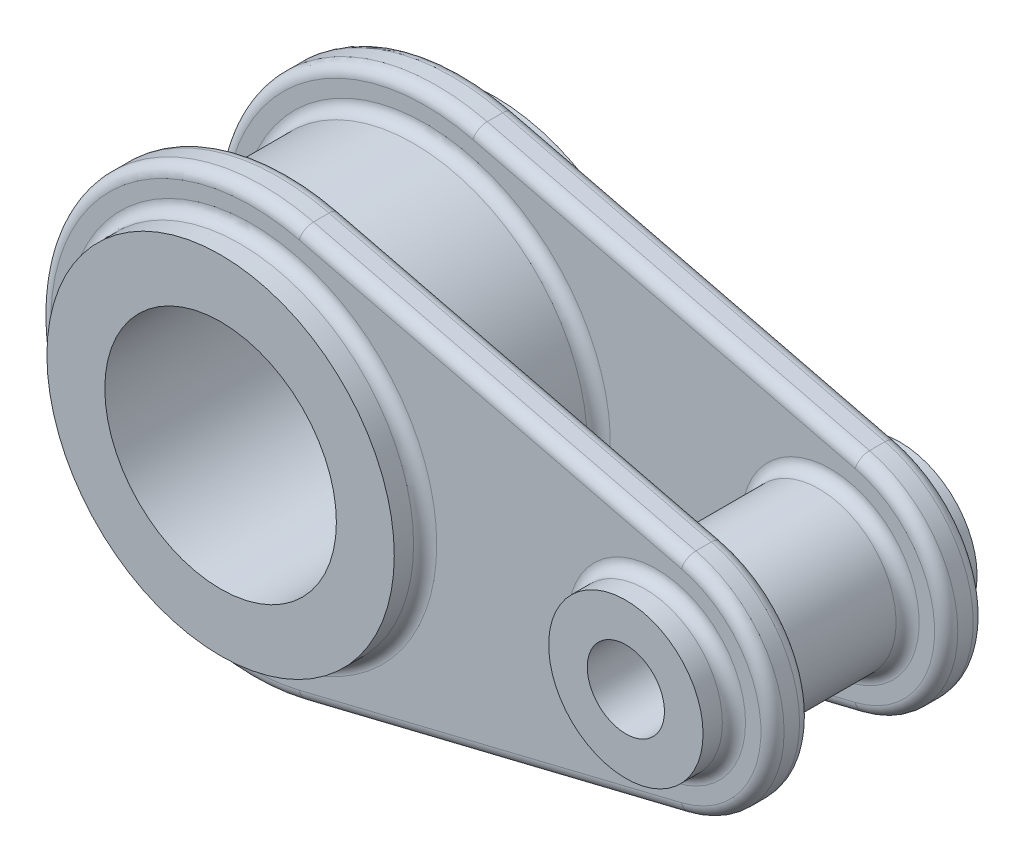
from build123d import *

# Parameters (mm, degrees)
SKETCH_1_R          = 45
EXTRUDE_1_DEPTH     = 35.5
SKETCH_1_R_2        = 20
EXTRUDE_1_2_DEPTH   = 35.5
EXTRUDE_2_DEPTH     = 10
SKETCH_3_R          = 30
SKETCH_3_R_2        = 10
CUT_EXTRUDE_1_DEPTH = 163.144996839
FILLET_1_R          = 3


with BuildPart() as part:
    # 草图1 → 凸台-拉伸1 (new, symmetric)
    with BuildSketch(Plane.XY):
        Circle(SKETCH_1_R)
    extrude(amount=EXTRUDE_1_DEPTH, both=True)



with BuildPart() as body_2:
    # 草图1 → Extrude 1 2 (new, symmetric)
    with BuildSketch(Plane.XY):
        with Locations((105, 0)):
            Circle(SKETCH_1_R_2)
    extrude(amount=EXTRUDE_1_2_DEPTH, both=True)


with BuildPart() as part_1:
    add(part.part)

    add(body_2.part)  # 凸台-拉伸2 merges body 2
    # 草图2 → 凸台-拉伸2 (add)
    with BuildSketch(Plane.XY.offset(17.5)):
        with BuildLine():
            Line((13.095238095, 53.418299666), (112.142857143, 29.137254363))
            ThreePointArc((112.142857143, 29.137254363), (135, 0), (112.142857143, -29.137254363))
            Line((112.142857143, -29.137254363), (13.095238095, -53.418299666))
            ThreePointArc((13.095238095, -53.418299666), (-55, 0), (13.095238095, 53.418299666))
        make_face()
    extrude_2 = extrude(amount=EXTRUDE_2_DEPTH)

    # 镜向1: 凸台-拉伸2 across plane
    add(extrude_2.mirror(Plane.XY))

    # 草图3 → 切除-拉伸1 (cut, through all)
    with BuildSketch(Plane.XY.offset(35.5)):
        Circle(SKETCH_3_R)
        with Locations((105, 0)):
            Circle(SKETCH_3_R_2)
    extrude(amount=-CUT_EXTRUDE_1_DEPTH, mode=Mode.SUBTRACT)

    # 圆角1
    fillet_1_edges = [part_1.edges().sort_by_distance(p)[0] for p in [
        (-45, 0, 27.5),
        (-55, 0, 17.5),
        (62.619047619, -41.277777015, 17.5),
        (135, 0, 17.5),
        (62.619047619, 41.277777015, 17.5),
        (-55, 0, 27.5),
        (62.619047619, -41.277777015, 27.5),
        (135, 0, 27.5),
        (62.619047619, 41.277777015, 27.5),
        (85, 0, 17.5),
        (85, 0, 27.5),
        (85, 0, -17.5),
        (-45, 0, -17.5),
        (-45, 0, -27.5),
        (85, 0, -27.5),
        (-55, 0, -27.5),
        (62.619047619, 41.277777015, -27.5),
        (135, 0, -27.5),
        (62.619047619, -41.277777015, -27.5),
        (-55, 0, -17.5),
        (62.619047619, -41.277777015, -17.5),
        (135, 0, -17.5),
        (62.619047619, 41.277777015, -17.5),
        (-45, 0, 17.5),
    ]]
    fillet(fillet_1_edges, radius=FILLET_1_R)


solid = part_1.part
